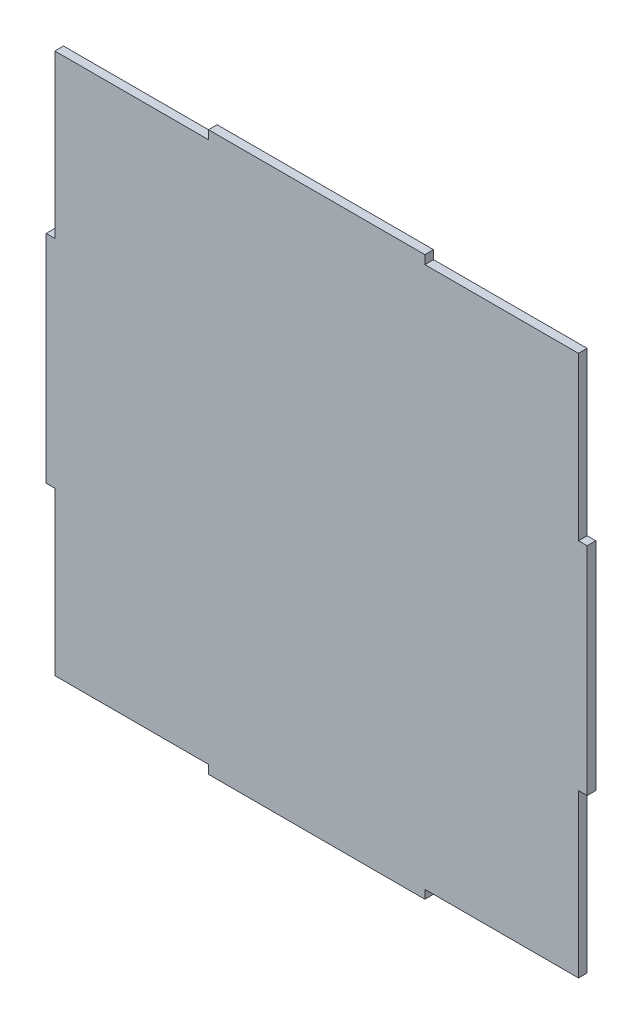
from build123d import *

# Parameters (mm, degrees)
BOSS_EXTRUDE1_DEPTH = 4


with BuildPart() as part:
    # Sketch1 → Boss-Extrude1 (new body)
    with BuildSketch(Plane.XY):
        Polygon((-50, 128.909239656), (-50, 124.909239656), (-121, 124.909239656), (-121, 49.909239656), (-125, 49.909239656), (-125, -50.090760344), (-121, -50.090760344), (-121, -125.090760344), (-50, -125.090760344), (-50, -129.090760344), (50, -129.090760344), (50, -125.090760344), (121, -125.090760344), (121, -50.090760344), (125, -50.090760344), (125, 49.909239656), (121, 49.909239656), (121, 124.909239656), (50, 124.909239656), (50, 128.909239656), align=None)
    extrude(amount=BOSS_EXTRUDE1_DEPTH)


solid = part.part
